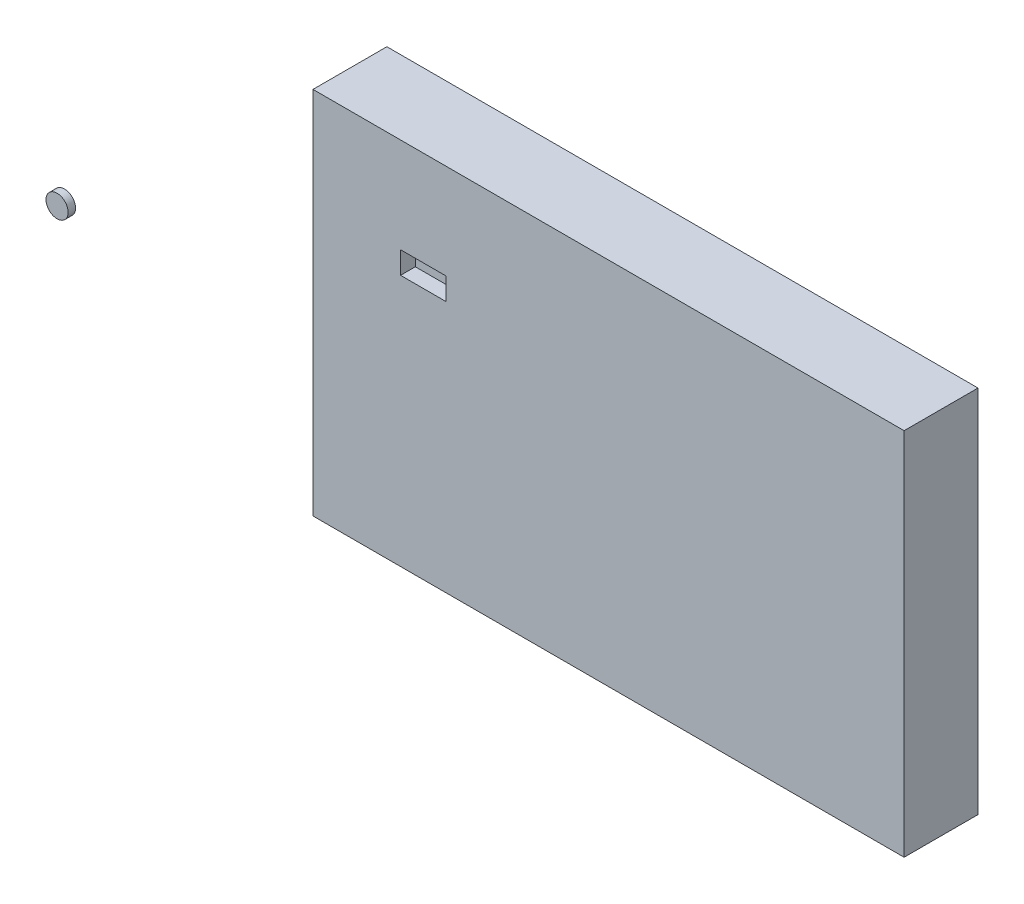
from build123d import *

# Parameters (mm, degrees)
SKETCH1_W           = 80
SKETCH1_H           = 50
BOSS_EXTRUDE1_DEPTH = 10
SKETCH2_W           = 6.15735252
SKETCH2_H           = 3
CUT_EXTRUDE1_DEPTH  = 2
SKETCH3_R           = 1.5
BOSS_EXTRUDE2_DEPTH = 1


with BuildPart() as part:
    # Sketch1 → Boss-Extrude1 (new body)
    with BuildSketch(Plane.XY):
        with Locations((40, 25)):
            Rectangle(SKETCH1_W, SKETCH1_H)
    extrude(amount=BOSS_EXTRUDE1_DEPTH)

    # Sketch2 → Cut-Extrude1 (cut)
    with BuildSketch(Plane.XY.offset(10)):
        with Locations((14.930431242, 35.634036602)):
            Rectangle(SKETCH2_W, SKETCH2_H)
    extrude(amount=-CUT_EXTRUDE1_DEPTH, mode=Mode.SUBTRACT)


with BuildPart() as body_2:
    # Sketch3 → Boss-Extrude2 (new body)
    with BuildSketch(Plane.XY):
        with Locations((-43.633587679, 10.014068158)):
            Circle(SKETCH3_R)
    extrude(amount=BOSS_EXTRUDE2_DEPTH)


solid = Compound([part.part, body_2.part])
